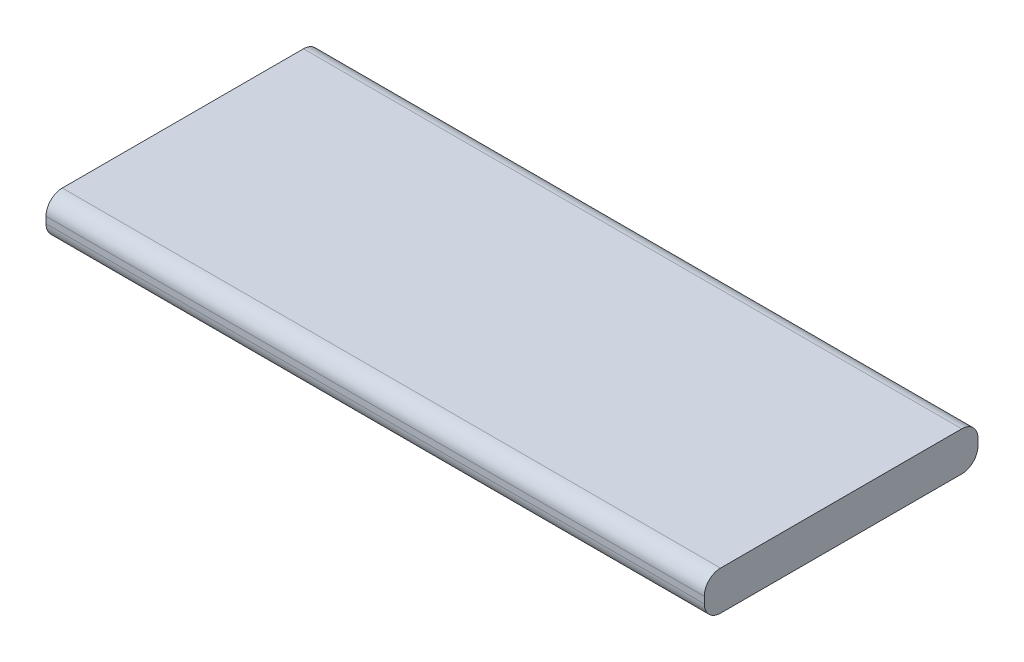
from build123d import *

# Parameters (mm, degrees)
SKETCH1_W           = 10.1
SKETCH1_H           = 4.2
BOSS_EXTRUDE1_DEPTH = 0.6
FILLET1_R           = 0.25
FILLET2_R           = 0.25


with BuildPart() as part:
    # Sketch1 → Boss-Extrude1 (new body)
    with BuildSketch(Plane(origin=(0, 0, 0), x_dir=(1, 0, 0), z_dir=(0, 1, 0))):
        Rectangle(SKETCH1_W, SKETCH1_H)
    extrude(amount=BOSS_EXTRUDE1_DEPTH)

    # Fillet1
    fillet1_edges = [part.edges().sort_by_distance(p)[0] for p in [
        (0, 0.6, -2.1),
        (0, 0.6, 2.1),
    ]]
    fillet(fillet1_edges, radius=FILLET1_R)

    # Fillet2
    fillet2_edges = [part.edges().sort_by_distance(p)[0] for p in [
        (0, 0, -2.1),
        (0, 0, 2.1),
    ]]
    fillet(fillet2_edges, radius=FILLET2_R)


solid = part.part
